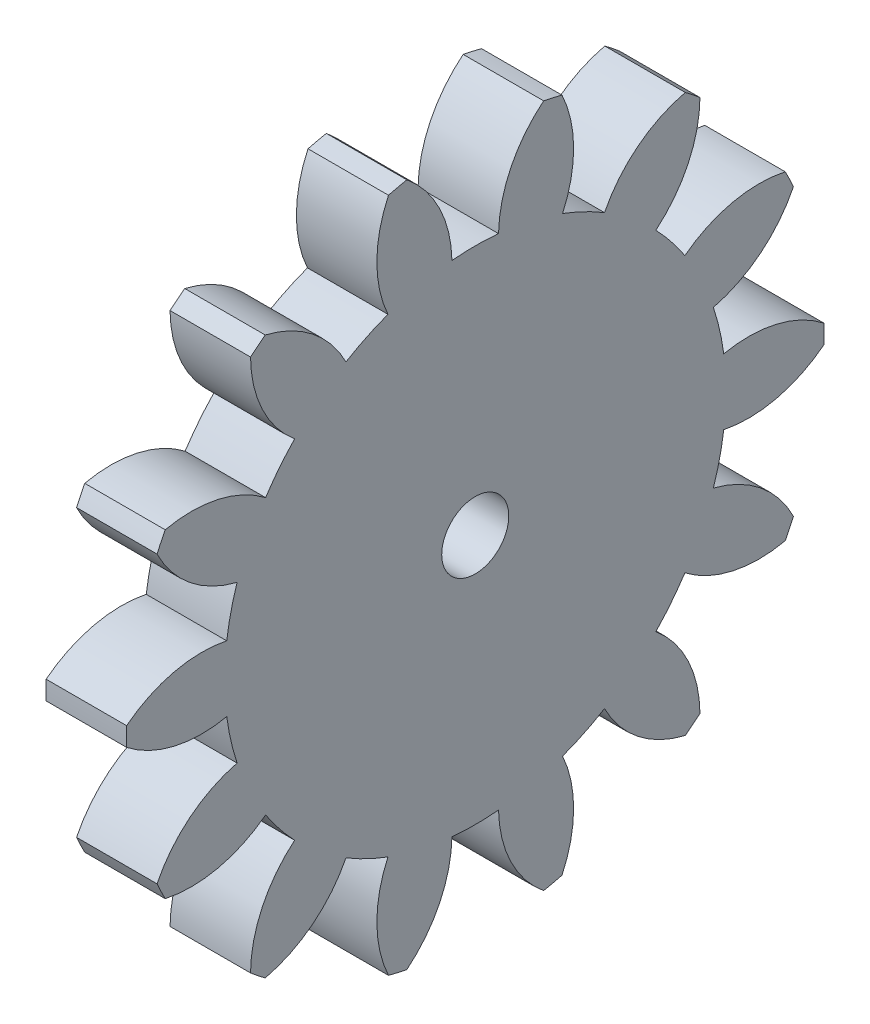
from build123d import *

# Parameters (mm, degrees)
BASPROSKE_W     = 12
BASPROSKE_H     = 52
TOOTHCUT_DEPTH  = 75.511744041
TEETHCUTS_COUNT = 14
TEETHCUTS_ANGLE = 334.285714286
BORSKE_R        = 5
BORE_DEPTH      = 50.0000508


with BuildPart() as part:
    # BasProSke → Base-Revolve (revolve)
    with BuildSketch(Plane(origin=(0, 0, 0), x_dir=(1, 0, 0), z_dir=(0, 1, 0)), mode=Mode.PRIVATE) as base_revolve_sk:
        with Locations((6, 26)):
            Rectangle(BASPROSKE_W, BASPROSKE_H)
    revolve(base_revolve_sk.sketch.rotate(Axis((-10, 0, 0), (1, 0, 0)), 180), axis=Axis((-10, 0, 0), (1, 0, 0)))

    # TooCutSke → ToothCut (cut, through all)
    with BuildSketch(Plane(origin=(0, 0, 0), x_dir=(0, 0, -1), z_dir=(1, 0, 0))):
        with BuildLine():
            ThreePointArc((3.472381495, 37.212342613), (0, 37.374), (-3.472381495, 37.212342613))
            ThreePointArc((-3.472381495, 37.212342613), (-5.321758163, 44.858902869), (-10.225500852, 51.010600638))
            ThreePointArc((-10.225500852, 51.010600638), (0, 52.0254), (10.225500852, 51.010600638))
            ThreePointArc((10.225500852, 51.010600638), (5.321758163, 44.858902869), (3.472381495, 37.212342613))
        make_face()
    toothcut = extrude(amount=TOOTHCUT_DEPTH, mode=Mode.SUBTRACT)

    # TeethCuts: ToothCut ×14 about axis
    teethcuts_axis = Axis((-10, 0, 0), (1, 0, 0))
    for i in range(1, TEETHCUTS_COUNT):
        add(toothcut.rotate(teethcuts_axis, i * TEETHCUTS_ANGLE / (TEETHCUTS_COUNT - 1)), mode=Mode.SUBTRACT)

    # BorSke → Bore (cut, symmetric)
    with BuildSketch(Plane(origin=(0, 0, 0), x_dir=(0, 0, -1), z_dir=(1, 0, 0))):
        with Locations(Location((0, 0, 0), (0, 0, 180))):
            Circle(BORSKE_R)
    extrude(amount=BORE_DEPTH, both=True, mode=Mode.SUBTRACT)


solid = part.part
